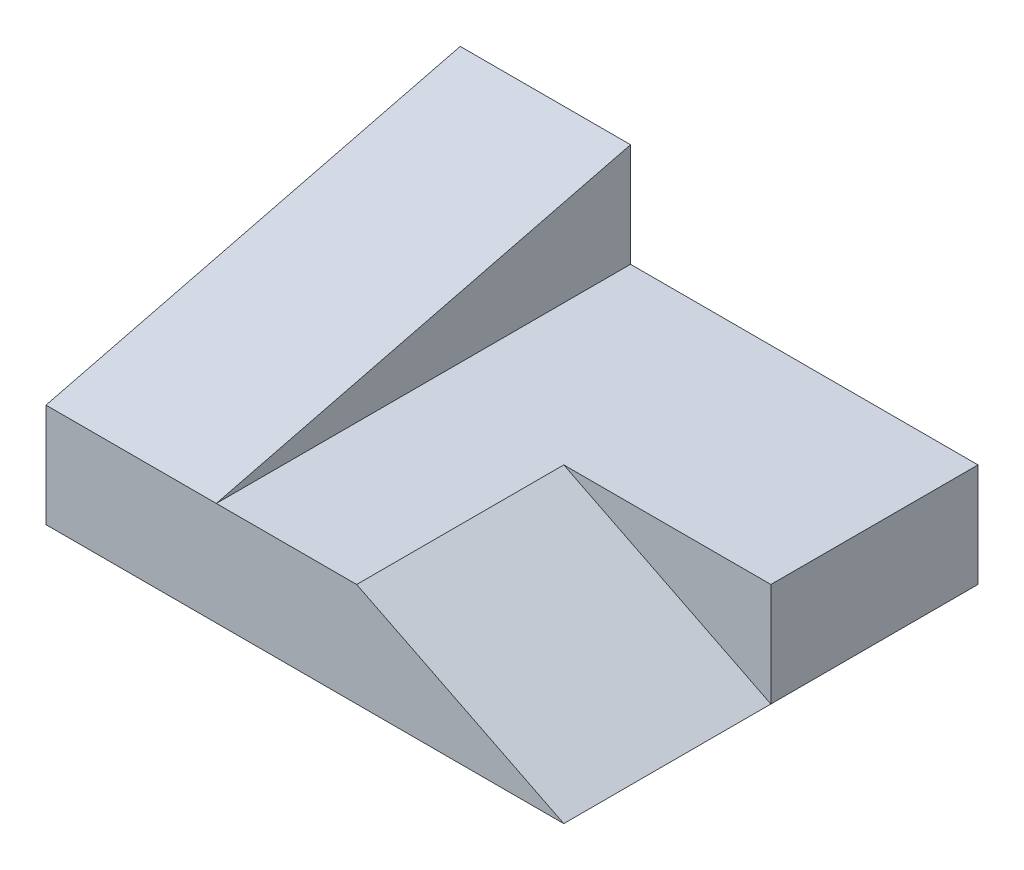
from build123d import *

# Parameters (mm, degrees)
SKETCH2_W           = 50
SKETCH2_H           = 40
BOSS_EXTRUDE1_DEPTH = 10
SKETCH3_W           = 16.446746845
SKETCH3_H           = 40
BOSS_EXTRUDE3_DEPTH = 10
CUT_EXTRUDE2_DEPTH  = 20
CUT_EXTRUDE3_DEPTH  = 20


with BuildPart() as part:
    # Sketch2 → Boss-Extrude1 (new body)
    with BuildSketch(Plane(origin=(0, 0, 0), x_dir=(1, 0, 0), z_dir=(0, 1, 0))):
        Rectangle(SKETCH2_W, SKETCH2_H)
    extrude(amount=BOSS_EXTRUDE1_DEPTH)

    # Sketch3 → Boss-Extrude3 (add)
    with BuildSketch(Plane(origin=(0, 10, 0), x_dir=(1, 0, 0), z_dir=(0, 1, 0))):
        with Locations((-16.776626578, 0)):
            Rectangle(SKETCH3_W, SKETCH3_H)
    extrude(amount=BOSS_EXTRUDE3_DEPTH)

    # Sketch5 → Cut-Extrude2 (cut)
    with BuildSketch(Plane(origin=(-8.553253155, 0, 0), x_dir=(0, 0, -1), z_dir=(1, 0, 0))):
        Polygon((-20, 10), (20, 20), (-20, 20), align=None)
    extrude(amount=-CUT_EXTRUDE2_DEPTH, mode=Mode.SUBTRACT)

    # Sketch6 → Cut-Extrude3 (cut)
    with BuildSketch(Plane.XY.offset(20)):
        Polygon((5, 10), (25, 0), (25, 10), align=None)
    extrude(amount=-CUT_EXTRUDE3_DEPTH, mode=Mode.SUBTRACT)


solid = part.part
